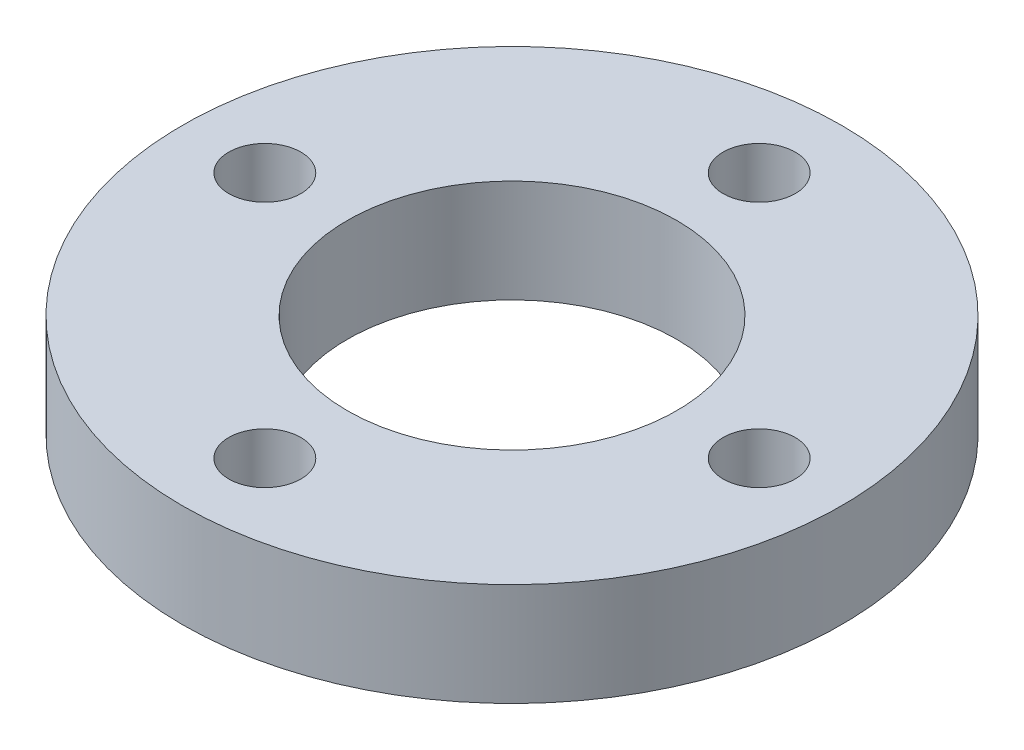
from build123d import *

# Parameters (mm, degrees)
SKETCH_1_R      = 16
SKETCH_1_R_2    = 8
SKETCH_1_R_3    = 1.75
EXTRUDE_1_DEPTH = 5


with BuildPart() as part:
    # 草图1 → 凸台-拉伸1 (new body)
    with BuildSketch(Plane(origin=(0, 0, 0), x_dir=(1, 0, 0), z_dir=(0, 1, 0))):
        with Locations(Location((0, 0, 0), (0, 0, 270))):
            Circle(SKETCH_1_R)
        with Locations(Location((0, 0, 0), (0, 0, 270))):
            Circle(SKETCH_1_R_2, mode=Mode.SUBTRACT)
        with Locations(Location((12, 0, 0), (0, 0, 270))):
            Circle(SKETCH_1_R_3, mode=Mode.SUBTRACT)
        with Locations(Location((0, -12, 0), (0, 0, 270))):
            Circle(SKETCH_1_R_3, mode=Mode.SUBTRACT)
        with Locations(Location((-12, 0, 0), (0, 0, 270))):
            Circle(SKETCH_1_R_3, mode=Mode.SUBTRACT)
        with Locations(Location((0, 12, 0), (0, 0, 270))):
            Circle(SKETCH_1_R_3, mode=Mode.SUBTRACT)
    extrude(amount=EXTRUDE_1_DEPTH)


solid = part.part
